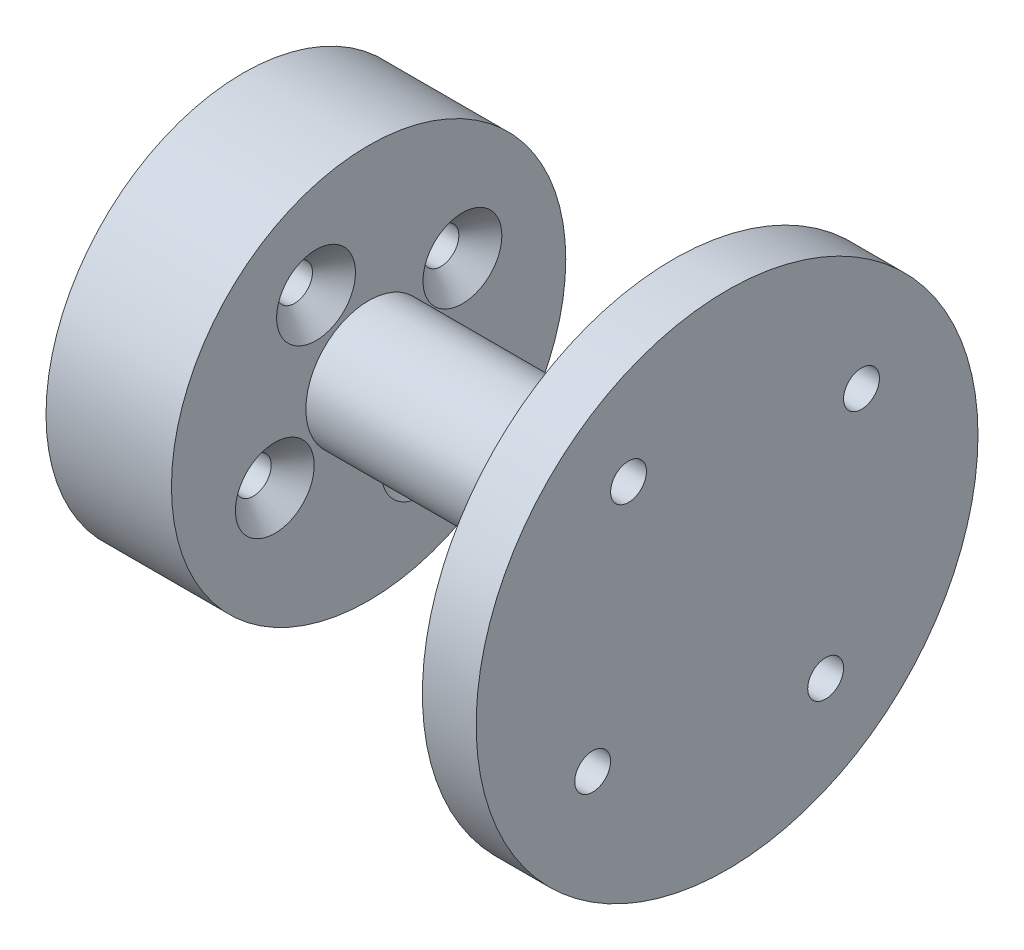
from build123d import *

# Parameters (mm, degrees)
HOLE_WIZARD_M22_D           = 2
HOLE_WIZARD_M22_CSINK_D     = 4.4
HOLE_WIZARD_M22_CSINK_ANGLE = 90
PATTERN_CIRCULAR_2_COUNT    = 4
SKETCH_6_R                  = 3.5
EXTRUDE_1_DEPTH             = 17
SKETCH_7_R                  = 14
EXTRUDE_2_DEPTH             = 3
CUT_EXTRUDE_1_REACH         = 35.481
SKETCH_8_R                  = 1
PATTERN_CIRCULAR_3_COUNT    = 4


with BuildPart() as part:
    # Эскиз1 → Повернуть1 (revolve)
    with BuildSketch(Plane.XY):
        Polygon((0, 10), (0, 11), (7, 11), (7, 0), (4, 0), (4, 10), align=None)
    revolve(axis=Axis((0, 0, 0), (1, 0, 0)))

    # Зенковка для  винта с плоской головкой M22 (through all)
    with Locations(Plane(origin=(7, 0, 0), x_dir=(0, 0, -1), z_dir=(1, 0, 0))):
        with Locations((-2.933383142, 5.234048466)):
            hole_wizard_m22 = CounterSinkHole(HOLE_WIZARD_M22_D / 2, HOLE_WIZARD_M22_CSINK_D / 2, counter_sink_angle=HOLE_WIZARD_M22_CSINK_ANGLE)

    # Круговой массив2: Зенковка для  винта с плоской головкой M22 ×4 about axis
    pattern_circular_2_axis = Axis((4, 0, 0), (-1, 0, 0))
    for i in range(1, PATTERN_CIRCULAR_2_COUNT):
        add(hole_wizard_m22.rotate(pattern_circular_2_axis, i * 360 / PATTERN_CIRCULAR_2_COUNT), mode=Mode.SUBTRACT)

    # Эскиз6 → Бобышка-Вытянуть1 (add)
    with BuildSketch(Plane(origin=(7, 0, 0), x_dir=(0, 0, -1), z_dir=(1, 0, 0))):
        Circle(SKETCH_6_R)
    extrude(amount=EXTRUDE_1_DEPTH)

    # Эскиз7 → Бобышка-Вытянуть2 (add)
    with BuildSketch(Plane(origin=(24, 0, 0), x_dir=(0, 0, -1), z_dir=(1, 0, 0))):
        Circle(SKETCH_7_R)
    extrude(amount=EXTRUDE_2_DEPTH)

    # Эскиз8 → Вырез-Вытянуть1 (cut, up to next)
    with BuildSketch(Plane(origin=(27, 0, 0), x_dir=(0, 0, -1), z_dir=(1, 0, 0)), mode=Mode.PRIVATE) as cut_extrude_1_sk1:
        with Locations((-5.499090834, 7.5)):
            Circle(SKETCH_8_R)
    cut_extrude_1_tool1 = extrude(cut_extrude_1_sk1.sketch, amount=-CUT_EXTRUDE_1_REACH, mode=Mode.PRIVATE) & part.part
    cut_extrude_1 = cut_extrude_1_tool1.solids().sort_by_distance((27, 7.5, 5.499091))[0]
    add(cut_extrude_1, mode=Mode.SUBTRACT)

    # Круговой массив3: Вырез-Вытянуть1 ×4 about axis
    pattern_circular_3_axis = Axis((4, 0, 0), (-1, 0, 0))
    for i in range(1, PATTERN_CIRCULAR_3_COUNT):
        add(cut_extrude_1.rotate(pattern_circular_3_axis, i * 360 / PATTERN_CIRCULAR_3_COUNT), mode=Mode.SUBTRACT)


solid = part.part
